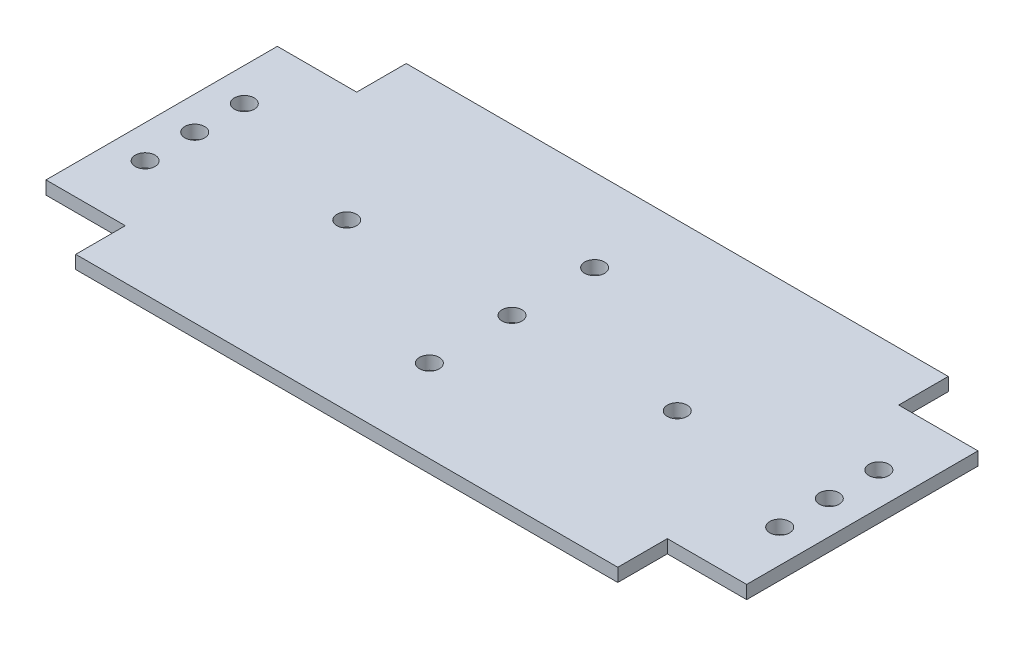
from build123d import *

# Parameters (mm, degrees)
SALIENTE_EXTRUIR1_DEPTH = 4
CROQUIS2_R              = 3
CORTAR_EXTRUIR1_DEPTH   = 4
CROQUIS3_R              = 3
CORTAR_EXTRUIR2_DEPTH   = 4
CROQUIS4_R              = 3
CORTAR_EXTRUIR3_DEPTH   = 4


with BuildPart() as part:
    # Croquis1 → Saliente-Extruir1 (new body)
    with BuildSketch(Plane(origin=(0, 0, 0), x_dir=(1, 0, 0), z_dir=(0, 1, 0))):
        Polygon((-82, -35), (-82, -50), (82, -50), (82, -35), (106, -35), (106, 35), (82, 35), (82, 50), (-82, 50), (-82, 35), (-106, 35), (-106, -35), align=None)
    extrude(amount=SALIENTE_EXTRUIR1_DEPTH)

    # Croquis2 → Cortar-Extruir1 (cut)
    with BuildSketch(Plane(origin=(0, 4, 0), x_dir=(1, 0, 0), z_dir=(0, 1, 0))):
        with Locations(Location((-96, 0, 0), (0, 0, 270))):
            Circle(CROQUIS2_R)
        with Locations(Location((-96, 15, 0), (0, 0, 270))):
            Circle(CROQUIS2_R)
        with Locations(Location((-96, -15, 0), (0, 0, 270))):
            Circle(CROQUIS2_R)
    extrude(amount=-CORTAR_EXTRUIR1_DEPTH, mode=Mode.SUBTRACT)

    # Croquis3 → Cortar-Extruir2 (cut)
    with BuildSketch(Plane(origin=(0, 4, 0), x_dir=(1, 0, 0), z_dir=(0, 1, 0))):
        with Locations(Location((96, 15, 0), (0, 0, 270))):
            Circle(CROQUIS3_R)
        with Locations(Location((96, -15, 0), (0, 0, 270))):
            Circle(CROQUIS3_R)
        with Locations(Location((96, 0, 0), (0, 0, 270))):
            Circle(CROQUIS3_R)
    extrude(amount=-CORTAR_EXTRUIR2_DEPTH, mode=Mode.SUBTRACT)

    # Croquis4 → Cortar-Extruir3 (cut)
    with BuildSketch(Plane(origin=(0, 4, 0), x_dir=(1, 0, 0), z_dir=(0, 1, 0))):
        with Locations(Location((0, 25, 0), (0, 0, 270))):
            Circle(CROQUIS4_R)
        with Locations(Location((50, 0, 0), (0, 0, 270))):
            Circle(CROQUIS4_R)
        with Locations(Location((0, -25, 0), (0, 0, 270))):
            Circle(CROQUIS4_R)
        with Locations(Location((-50, 0, 0), (0, 0, 270))):
            Circle(CROQUIS4_R)
        with Locations(Location((0, 0, 0), (0, 0, 270))):
            Circle(CROQUIS4_R)
    extrude(amount=-CORTAR_EXTRUIR3_DEPTH, mode=Mode.SUBTRACT)


solid = part.part
